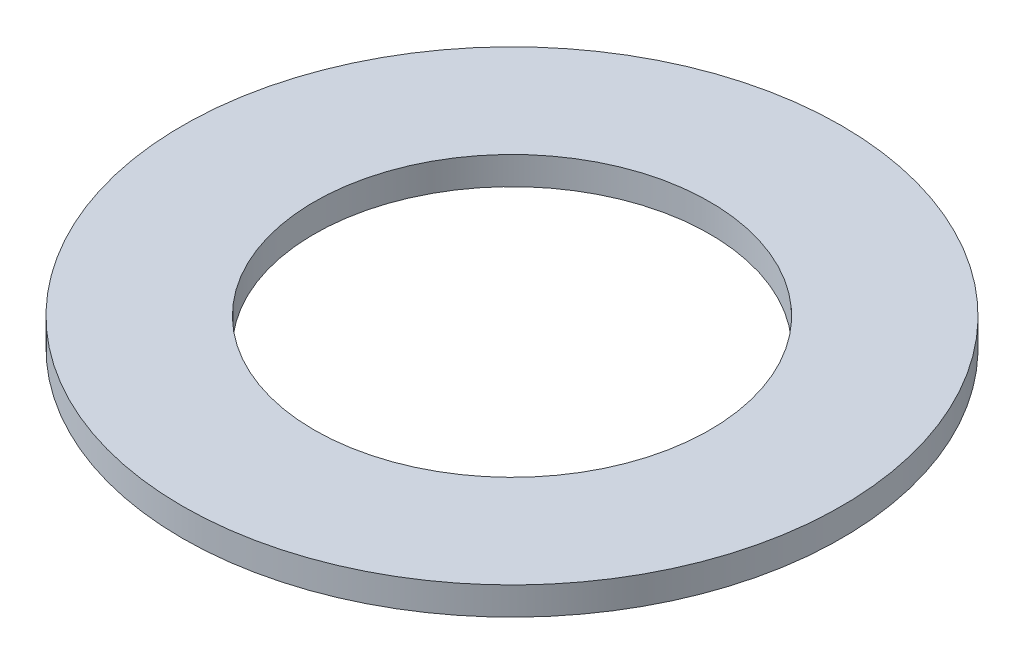
from build123d import *

# Parameters (mm, degrees)
SKETCH1_R           = 75
BOSS_EXTRUDE1_DEPTH = 6.35
SKETCH2_R           = 45
CUT_EXTRUDE1_DEPTH  = 107.255929246


with BuildPart() as part:
    # Sketch1 → Boss-Extrude1 (new body)
    with BuildSketch(Plane(origin=(0, 0, 0), x_dir=(1, 0, 0), z_dir=(0, 1, 0))):
        with Locations(Location((0, 0, 0), (0, 0, 270))):
            Circle(SKETCH1_R)
    extrude(amount=BOSS_EXTRUDE1_DEPTH)

    # Sketch2 → Cut-Extrude1 (cut, through all)
    with BuildSketch(Plane(origin=(0, 6.35, 0), x_dir=(1, 0, 0), z_dir=(0, 1, 0))):
        with Locations(Location((0, 0, 0), (0, 0, 270))):
            Circle(SKETCH2_R)
    extrude(amount=-CUT_EXTRUDE1_DEPTH, mode=Mode.SUBTRACT)


solid = part.part
